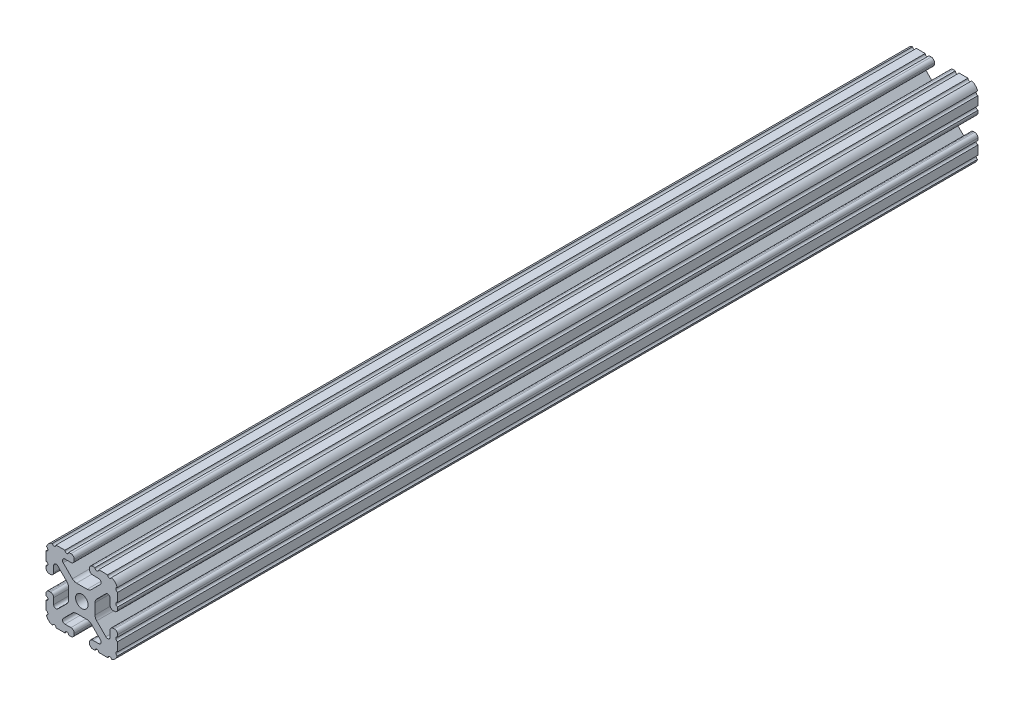
from build123d import *

# Parameters (mm, degrees)
BOSS_EXTRUDE1_DEPTH     = 228.6
CUT_EXTRUDE1_DEPTH      = 231.182025797
CUT_EXTRUDE1_DEPTH_BACK = 231.182025797
SKETCH5_R               = 1.016


with BuildPart() as part:
    # Sketch4 → Boss-Extrude1 (new, symmetric)
    with BuildSketch(Plane.XY):
        with BuildLine():
            Line((5.7912, -19.05), (14.3002, -19.05))
            ThreePointArc((14.3002, -19.05), (17.658815789, -17.658815789), (19.05, -14.3002))
            Line((19.05, -14.3002), (19.05, -5.7912))
            ThreePointArc((19.05, -5.7912), (18.544114832, -4.569885168), (17.3228, -4.064))
            Line((17.3228, -4.064), (16.7132, -4.064))
            ThreePointArc((16.7132, -4.064), (15.491885168, -4.569885168), (14.986, -5.7912))
            Line((14.986, -5.7912), (14.986, -8.996305235))
            ThreePointArc((14.986, -8.996305235), (14.189232738, -10.188751711), (12.782646215, -9.908964256))
            Line((12.782646215, -9.908964256), (7.888897763, -5.015215804))
            ThreePointArc((7.888897763, -5.015215804), (7.219915375, -4.014012907), (6.985, -2.833013566))
            Line((6.985, -2.833013566), (6.985, 0))
            Line((6.985, 0), (3.3274, 0))
            ThreePointArc((3.3274, 0), (2.352827104, -2.352827104), (0, -3.3274))
            Line((0, -3.3274), (0, -6.985))
            Line((0, -6.985), (2.833013566, -6.985))
            ThreePointArc((2.833013566, -6.985), (4.014012907, -7.219915375), (5.015215804, -7.888897763))
            Line((5.015215804, -7.888897763), (9.908964256, -12.782646215))
            ThreePointArc((9.908964256, -12.782646215), (10.188751711, -14.189232738), (8.996305235, -14.986))
            Line((8.996305235, -14.986), (5.7912, -14.986))
            ThreePointArc((5.7912, -14.986), (4.569885168, -15.491885168), (4.064, -16.7132))
            Line((4.064, -16.7132), (4.064, -17.3228))
            ThreePointArc((4.064, -17.3228), (4.569885168, -18.544114832), (5.7912, -19.05))
        make_face()
    extrude(amount=BOSS_EXTRUDE1_DEPTH, both=True)

    # Sketch5 → Cut-Extrude1 (cut, two sides: drawn at the far end of the back side and taken through both)
    with BuildSketch(Plane.XY.offset(-CUT_EXTRUDE1_DEPTH_BACK)):
        with Locations((14.739477062, -19.05)):
            Circle(SKETCH5_R)
        with Locations((7.980305235, -19.05)):
            Circle(SKETCH5_R)
        with Locations((19.05, -14.739477062)):
            Circle(SKETCH5_R)
        with Locations((19.05, -7.980305235)):
            Circle(SKETCH5_R)
    extrude(amount=CUT_EXTRUDE1_DEPTH + CUT_EXTRUDE1_DEPTH_BACK, mode=Mode.SUBTRACT)

    # Mirror1: part across plane


with BuildPart() as part_1:
    add(part.part)
    add(part.part.mirror(Plane(origin=(0, 0, 0), x_dir=(0, 0, 1), z_dir=(1, 0, 0))))

    # Mirror2: part across plane


with BuildPart() as part_2:
    add(part_1.part)
    add(part_1.part.mirror(Plane.ZX))


solid = part_2.part
